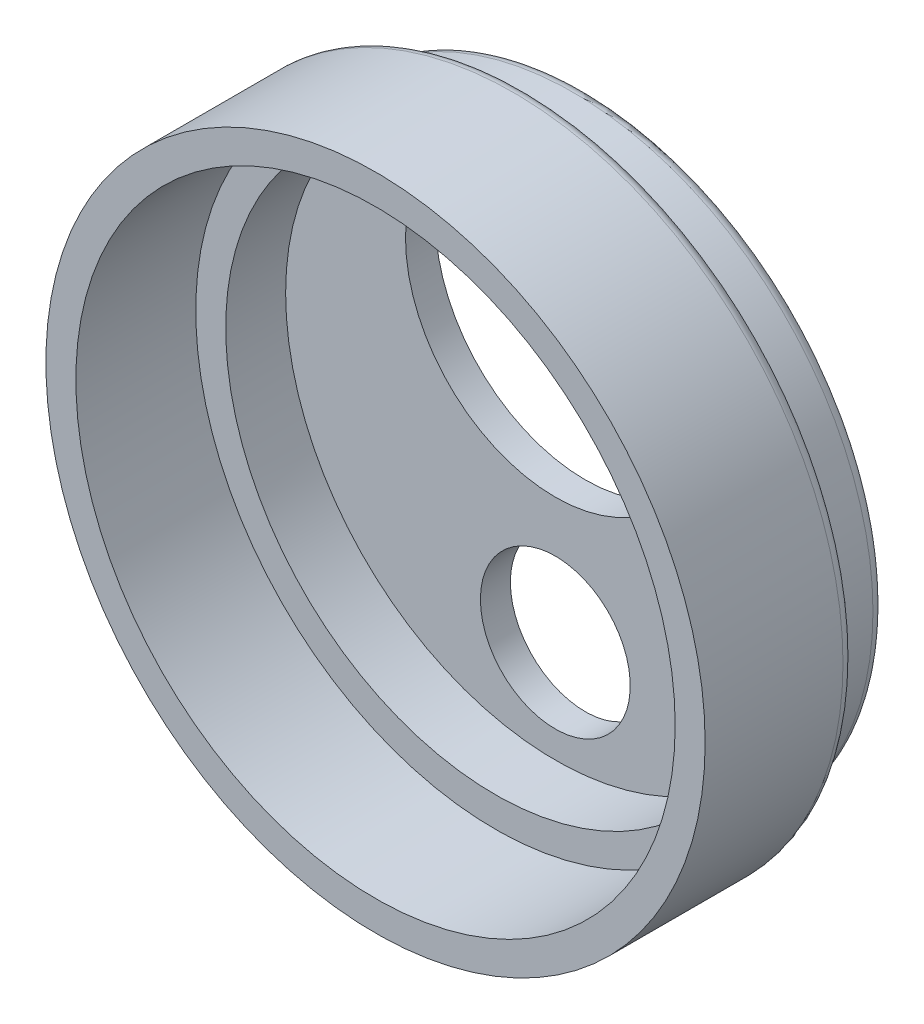
from build123d import *

# Parameters (mm, degrees)
ESBO_O1_R                = 55
RESSALTO_EXTRUS_O1_DEPTH = 25
ESBO_O2_R                = 50
RESSALTO_EXTRUS_O2_DEPTH = 10
CASCA1_T                 = -5
FILETE2_R                = 2
FILETE3_R                = 2
ESBO_O3_R                = 25
ESBO_O3_R_2              = 12.5
CORTE_EXTRUS_O1_DEPTH    = 86.293610546


with BuildPart() as part:
    # Esboço1 → Ressalto-extrusão1 (new body)
    with BuildSketch(Plane.XY):
        Circle(ESBO_O1_R)
    extrude(amount=RESSALTO_EXTRUS_O1_DEPTH)

    # Esboço2 → Ressalto-extrusão2 (add)
    with BuildSketch(Plane(origin=(0, 0, 0), x_dir=(-1, 0, 0), z_dir=(0, 0, -1))):
        Circle(ESBO_O2_R)
    extrude(amount=RESSALTO_EXTRUS_O2_DEPTH)

    # Casca1
    casca1_openings = [part.faces().sort_by_distance(p)[0] for p in [
        (0, 0, 25),
    ]]
    offset(amount=CASCA1_T, openings=casca1_openings, kind=Kind.INTERSECTION)

    # Filete2
    filete2_edges = [part.edges().sort_by_distance(p)[0] for p in [
        (50, 0, 0),
        (50, 0, -10),
    ]]
    fillet(filete2_edges, radius=FILETE2_R)

    # Filete3
    filete3_edges = [part.edges().sort_by_distance(p)[0] for p in [
        (-55, 0, 0),
    ]]
    fillet(filete3_edges, radius=FILETE3_R)

    # Esboço3 → Corte-extrusão1 (cut, through all)
    with BuildSketch(Plane(origin=(0, 0, -10), x_dir=(-1, 0, 0), z_dir=(0, 0, -1))):
        with Locations((0, 18)):
            Circle(ESBO_O3_R)
        with Locations((0, -28)):
            Circle(ESBO_O3_R_2)
    extrude(amount=-CORTE_EXTRUS_O1_DEPTH, mode=Mode.SUBTRACT)


solid = part.part
